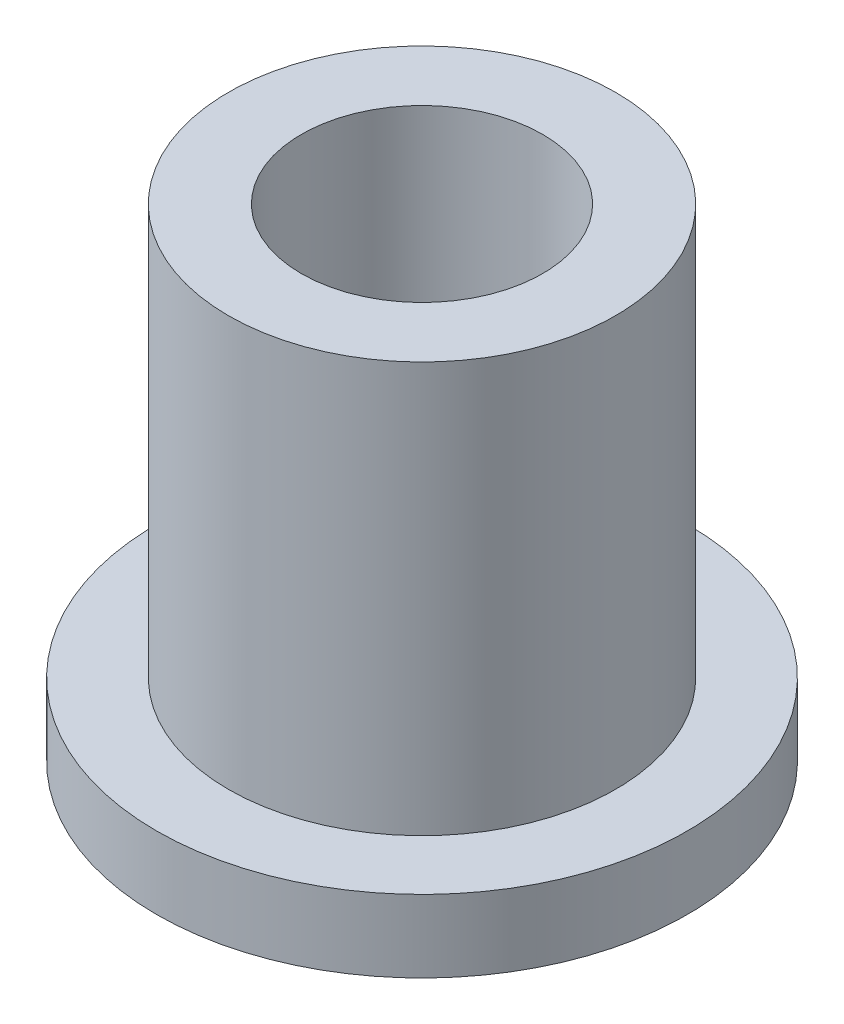
from build123d import *

# Parameters (mm, degrees)
SKETCH2_R           = 4.01
SKETCH2_R_2         = 2.5
BOSS_EXTRUDE1_DEPTH = 10
SKETCH3_R           = 5.5
SKETCH3_R_2         = 4.01
BOSS_EXTRUDE2_DEPTH = 1.5


with BuildPart() as part:
    # Sketch2 → Boss-Extrude1 (new body)
    with BuildSketch(Plane(origin=(0, 0, 0), x_dir=(1, 0, 0), z_dir=(0, 1, 0))):
        Circle(SKETCH2_R)
        Circle(SKETCH2_R_2, mode=Mode.SUBTRACT)
    extrude(amount=BOSS_EXTRUDE1_DEPTH)

    # Sketch3 → Boss-Extrude2 (add)
    with BuildSketch(Plane(origin=(0, 0, 0), x_dir=(1, 0, 0), z_dir=(0, 1, 0))):
        Circle(SKETCH3_R)
        Circle(SKETCH3_R_2, mode=Mode.SUBTRACT)
    extrude(amount=BOSS_EXTRUDE2_DEPTH)


solid = part.part
